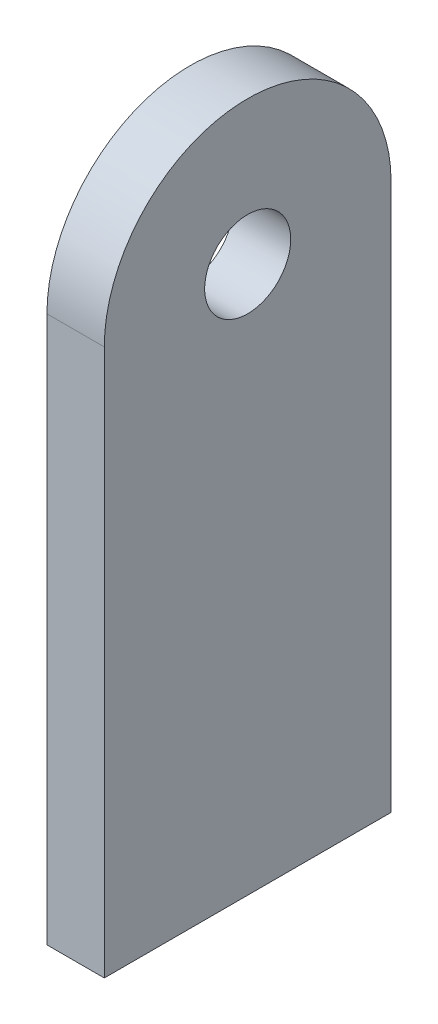
from build123d import *

# Parameters (mm, degrees)
SKETCH1_R           = 7.5
BOSS_EXTRUDE1_DEPTH = 10


with BuildPart() as part:
    # Sketch1 → Boss-Extrude1 (new body)
    with BuildSketch(Plane(origin=(0, 0, 0), x_dir=(0, 0, -1), z_dir=(1, 0, 0))):
        with BuildLine():
            Line((-25, -44.722703321), (25, -44.722703321))
            Line((25, -44.722703321), (25, 50.567397879))
            ThreePointArc((25, 50.567397879), (0, 75.567397879), (-25, 50.567397879))
            Line((-25, 50.567397879), (-25, -44.722703321))
        make_face()
        with Locations((0, 50.567397879)):
            Circle(SKETCH1_R, mode=Mode.SUBTRACT)
    extrude(amount=BOSS_EXTRUDE1_DEPTH)


solid = part.part
